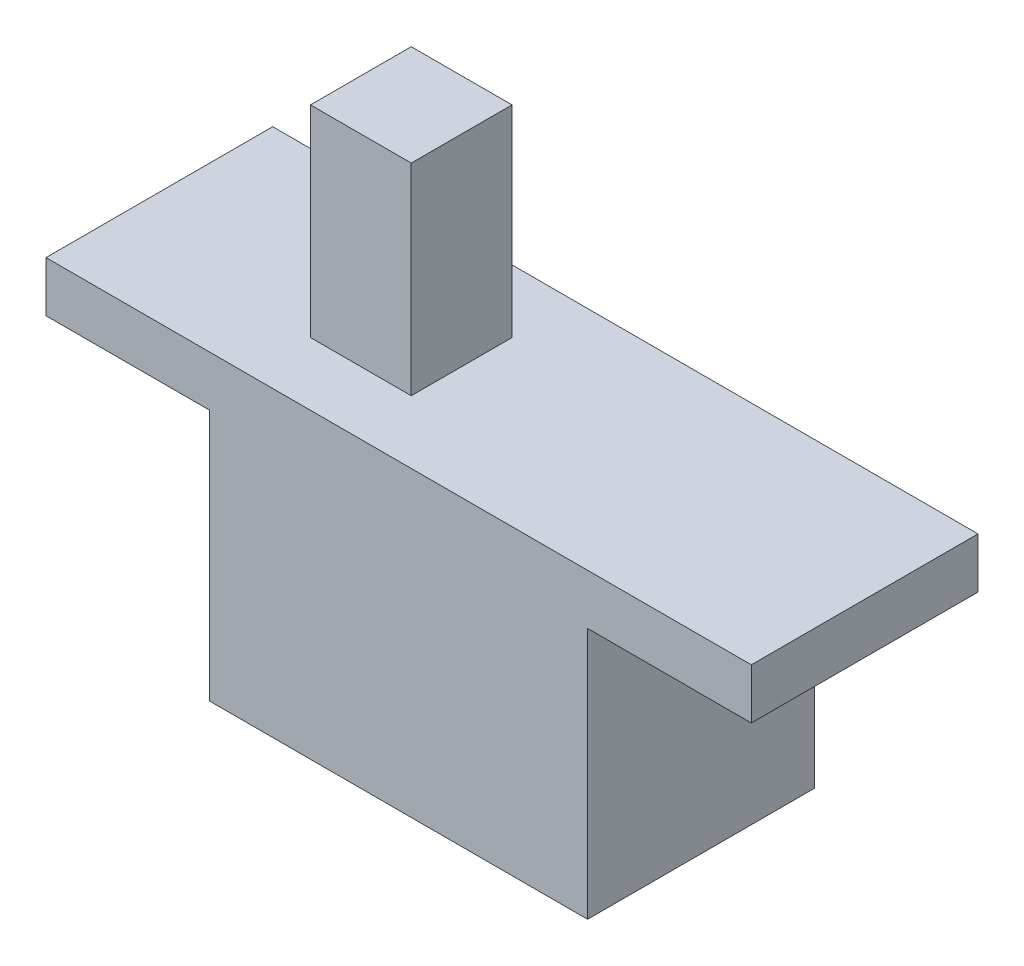
from build123d import *

# Parameters (mm, degrees)
CROQUIS1_W              = 14
CROQUIS1_H              = 4.5
SALIENTE_EXTRUIR1_DEPTH = 1
CROQUIS2_W              = 7.5
CROQUIS2_H              = 4.5
SALIENTE_EXTRUIR2_DEPTH = 6
CROQUIS3_W              = 2
CROQUIS3_H              = 2
SALIENTE_EXTRUIR3_DEPTH = 4


with BuildPart() as part:
    # Croquis1 → Saliente-Extruir1 (new body)
    with BuildSketch(Plane(origin=(0, 0, 0), x_dir=(1, 0, 0), z_dir=(0, 1, 0))):
        with Locations((7, 2.25)):
            Rectangle(CROQUIS1_W, CROQUIS1_H)
    extrude(amount=SALIENTE_EXTRUIR1_DEPTH)

    # Croquis2 → Saliente-Extruir2 (add)
    with BuildSketch(Plane(origin=(0, 1, 0), x_dir=(1, 0, 0), z_dir=(0, 1, 0))):
        with Locations((7, 2.25)):
            Rectangle(CROQUIS2_W, CROQUIS2_H)
    extrude(amount=-SALIENTE_EXTRUIR2_DEPTH)

    # Croquis3 → Saliente-Extruir3 (add)
    with BuildSketch(Plane(origin=(0, 1, 0), x_dir=(1, 0, 0), z_dir=(0, 1, 0))):
        with Locations((5, 2.25)):
            Rectangle(CROQUIS3_W, CROQUIS3_H)
    extrude(amount=SALIENTE_EXTRUIR3_DEPTH)


solid = part.part
